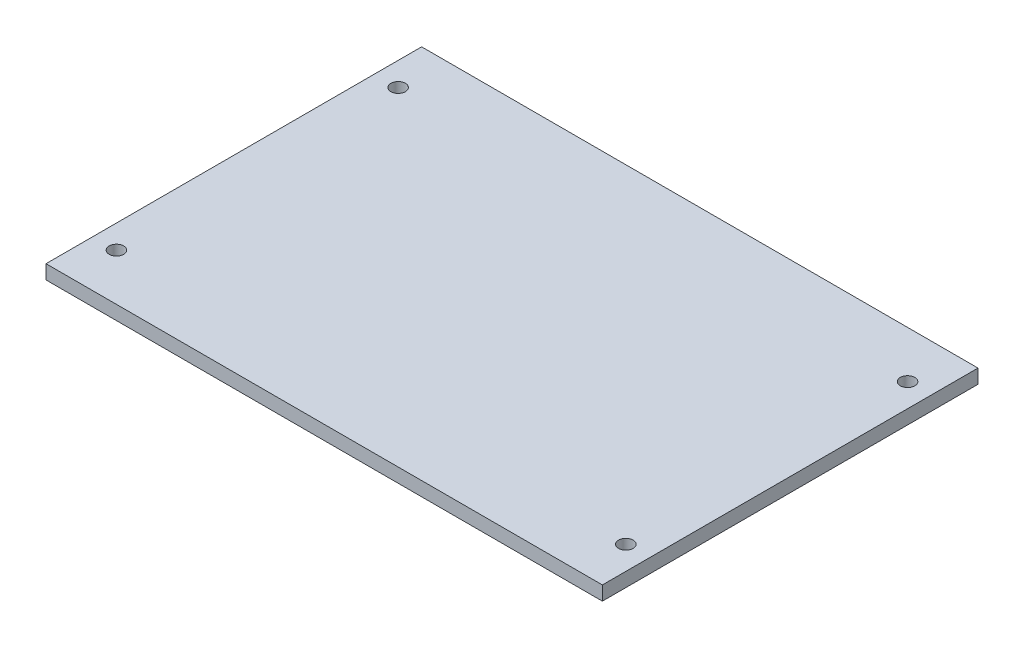
from build123d import *

# Parameters (mm, degrees)
SKETCH_1_W          = 118.5
SKETCH_1_H          = 3
EXTRUDE_1_DEPTH     = 80
CUT_EXTRUDE_1_REACH = 145.008
SKETCH_2_R          = 1.55


with BuildPart() as part:
    # 草图1 → 凸台-拉伸1 (new body)
    with BuildSketch(Plane.XY):
        with Locations((59.25, 1.5)):
            Rectangle(SKETCH_1_W, SKETCH_1_H)
    extrude(amount=EXTRUDE_1_DEPTH)

    # 草图2 → 切除-拉伸1 (cut, up to next)
    with BuildSketch(Plane(origin=(0, 3, 0), x_dir=(1, 0, 0), z_dir=(0, 1, 0)), mode=Mode.PRIVATE) as cut_extrude_1_sk1:
        with Locations(Location((5, -10, 0), (0, 0, 270))):
            Circle(SKETCH_2_R)
    cut_extrude_1_tool1 = extrude(cut_extrude_1_sk1.sketch, amount=-CUT_EXTRUDE_1_REACH, mode=Mode.PRIVATE) & part.part
    # 草图2 → 切除-拉伸1 (cut, up to next)
    with BuildSketch(Plane(origin=(0, 3, 0), x_dir=(1, 0, 0), z_dir=(0, 1, 0)), mode=Mode.PRIVATE) as cut_extrude_1_sk2:
        with Locations(Location((5, -70, 0), (0, 0, 270))):
            Circle(SKETCH_2_R)
    cut_extrude_1_tool2 = extrude(cut_extrude_1_sk2.sketch, amount=-CUT_EXTRUDE_1_REACH, mode=Mode.PRIVATE) & part.part
    # 草图2 → 切除-拉伸1 (cut, up to next)
    with BuildSketch(Plane(origin=(0, 3, 0), x_dir=(1, 0, 0), z_dir=(0, 1, 0)), mode=Mode.PRIVATE) as cut_extrude_1_sk3:
        with Locations(Location((113.5, -70, 0), (0, 0, 270))):
            Circle(SKETCH_2_R)
    cut_extrude_1_tool3 = extrude(cut_extrude_1_sk3.sketch, amount=-CUT_EXTRUDE_1_REACH, mode=Mode.PRIVATE) & part.part
    # 草图2 → 切除-拉伸1 (cut, up to next)
    with BuildSketch(Plane(origin=(0, 3, 0), x_dir=(1, 0, 0), z_dir=(0, 1, 0)), mode=Mode.PRIVATE) as cut_extrude_1_sk4:
        with Locations(Location((113.5, -10, 0), (0, 0, 270))):
            Circle(SKETCH_2_R)
    cut_extrude_1_tool4 = extrude(cut_extrude_1_sk4.sketch, amount=-CUT_EXTRUDE_1_REACH, mode=Mode.PRIVATE) & part.part
    add(cut_extrude_1_tool1.solids().sort_by_distance((5, 3, 10))[0], mode=Mode.SUBTRACT)
    add(cut_extrude_1_tool2.solids().sort_by_distance((5, 3, 70))[0], mode=Mode.SUBTRACT)
    add(cut_extrude_1_tool3.solids().sort_by_distance((113.5, 3, 70))[0], mode=Mode.SUBTRACT)
    add(cut_extrude_1_tool4.solids().sort_by_distance((113.5, 3, 10))[0], mode=Mode.SUBTRACT)


solid = part.part
